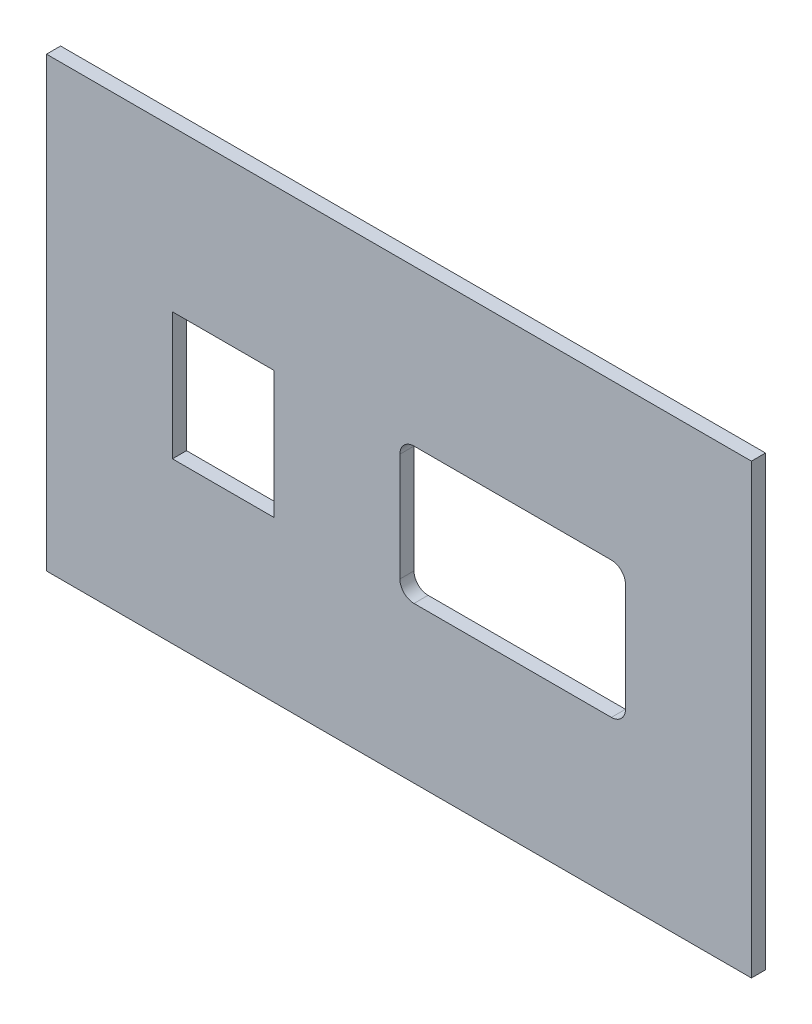
from build123d import *

# Parameters (mm, degrees)
SKETCH_1_W          = 150
SKETCH_1_H          = 95.25
EXTRUDE_1_DEPTH     = 3
SKETCH_1_3_W        = 21.6
SKETCH_1_3_H        = 27.1
CUT_EXTRUDE_2_DEPTH = 3


with BuildPart() as part:
    # 草圖1 → 填料-伸長1 (new body)
    with BuildSketch(Plane.XY):
        Rectangle(SKETCH_1_W, SKETCH_1_H)
    extrude(amount=EXTRUDE_1_DEPTH)

    # 草圖1<3> → 除料-伸長2 (cut)
    with BuildSketch(Plane.XY):
        with Locations((-37.4, 0)):
            Rectangle(SKETCH_1_3_W, SKETCH_1_3_H)
        with BuildLine():
            Line((45.2, 14.5), (3.2, 14.5))
            ThreePointArc((3.2, 14.5), (1.078679656, 13.621320344), (0.2, 11.5))
            Line((0.2, 11.5), (0.2, -11.5))
            ThreePointArc((0.2, -11.5), (1.078679656, -13.621320344), (3.2, -14.5))
            Line((3.2, -14.5), (45.2, -14.5))
            ThreePointArc((45.2, -14.5), (47.321320344, -13.621320344), (48.2, -11.5))
            Line((48.2, -11.5), (48.2, 11.5))
            ThreePointArc((48.2, 11.5), (47.321320344, 13.621320344), (45.2, 14.5))
        make_face()
    extrude(amount=CUT_EXTRUDE_2_DEPTH, mode=Mode.SUBTRACT)


solid = part.part
